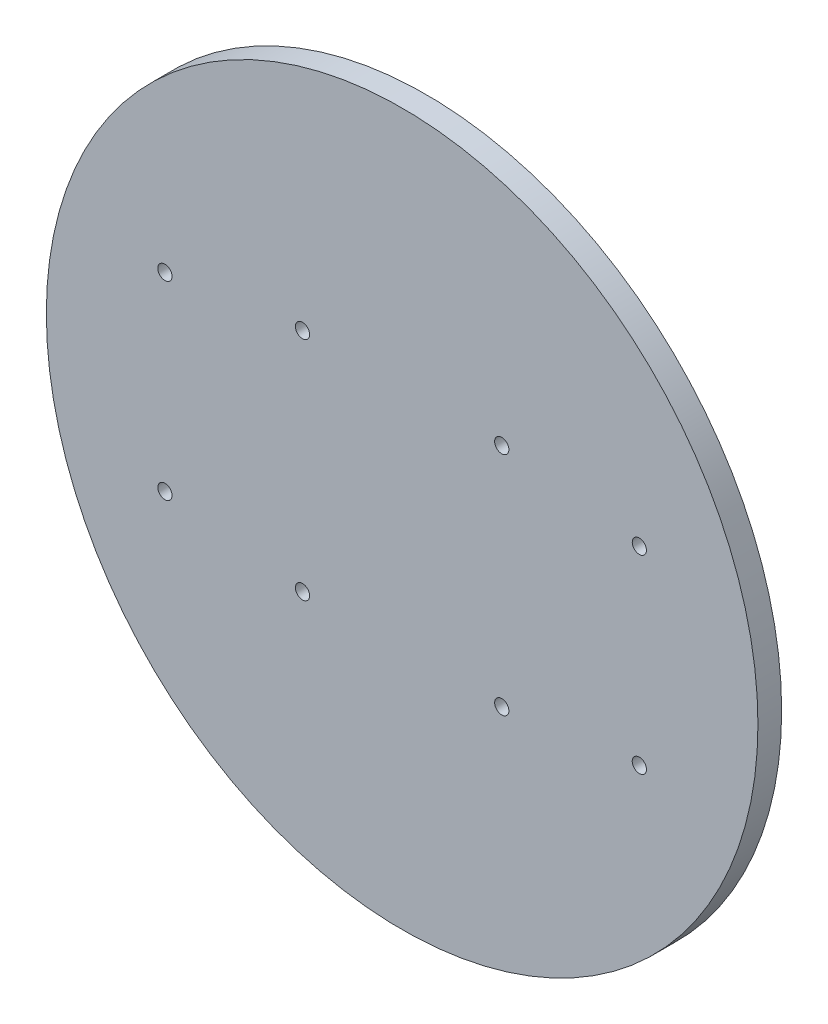
from build123d import *

# Parameters (mm, degrees)
CROQUIS1_R              = 75
SALIENTE_EXTRUIR1_DEPTH = 5
CROQUIS2_R              = 1.5
CORTAR_EXTRUIR1_DEPTH   = 107.183802908


with BuildPart() as part:
    # Croquis1 → Saliente-Extruir1 (new body)
    with BuildSketch(Plane.XY):
        Circle(CROQUIS1_R)
    extrude(amount=SALIENTE_EXTRUIR1_DEPTH)

    # Croquis2 → Cortar-Extruir1 (cut, through all)
    with BuildSketch(Plane.XY.offset(5)):
        with Locations((-50, 20)):
            Circle(CROQUIS2_R)
        with Locations(Location((-50, -20, 0), (0, 0, 180))):
            Circle(CROQUIS2_R)
        with Locations((50, -20)):
            Circle(CROQUIS2_R)
        with Locations(Location((50, 20, 0), (0, 0, 180))):
            Circle(CROQUIS2_R)
        with Locations((21, 23.876)):
            Circle(CROQUIS2_R)
        with Locations((-21, 23.876)):
            Circle(CROQUIS2_R)
        with Locations((-21, -23.8)):
            Circle(CROQUIS2_R)
        with Locations((21, -23.8)):
            Circle(CROQUIS2_R)
    extrude(amount=-CORTAR_EXTRUIR1_DEPTH, mode=Mode.SUBTRACT)


solid = part.part
